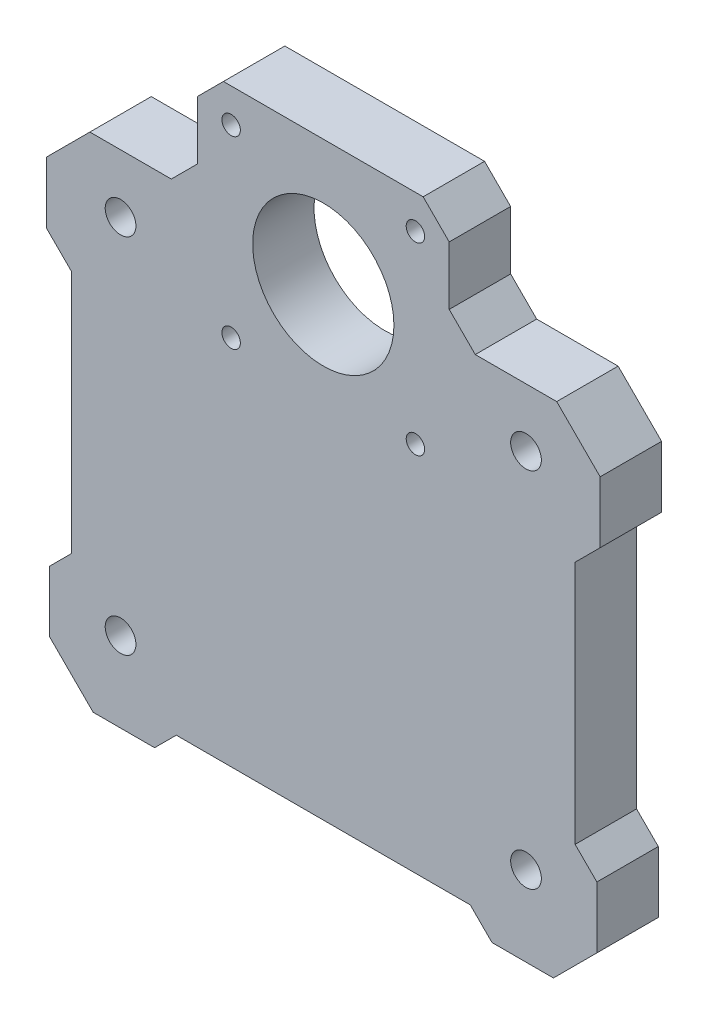
from build123d import *

# Parameters (mm, degrees)
SALIENTE_EXTRUIR5_DEPTH = 10
CROQUIS5_R              = 1.5
CORTAR_EXTRUIR1_DEPTH   = 71.922492906
SALIENTE_EXTRUIR7_DEPTH = 10
CORTAR_EXTRUIR2_DEPTH   = 74.351217807


with BuildPart() as part:
    # Croquis1 → Saliente-Extruir5 (new body)
    with BuildSketch(Plane.XY):
        with BuildLine():
            Line((-20.5, 29.5), (-30.5, 29.5))
            ThreePointArc((-30.5, 29.5), (-31.232233047, 27.732233047), (-33, 27))
            Line((-33, 27), (-33, -27))
            ThreePointArc((-33, -27), (-31.232233047, -27.732233047), (-30.5, -29.5))
            Line((-30.5, -29.5), (30.5, -29.5))
            ThreePointArc((30.5, -29.5), (31.232233047, -27.732233047), (33, -27))
            Line((33, -27), (33, 27))
            ThreePointArc((33, 27), (31.232233047, 27.732233047), (30.5, 29.5))
            Line((30.5, 29.5), (20.5, 29.5))
            Line((20.5, 29.5), (20.5, 16))
            Line((20.5, 16), (-20.5, 16))
            Line((-20.5, 16), (-20.5, 29.5))
        make_face()
        with BuildLine():
            Line((-9.124143795, 29.5), (-20.5, 29.5))
            Line((-20.5, 29.5), (-20.5, 16))
            Line((-20.5, 16), (20.5, 16))
            Line((20.5, 16), (20.5, 29.5))
            Line((20.5, 29.5), (9.124143795, 29.5))
            ThreePointArc((9.124143795, 29.5), (0, 25), (-9.124143795, 29.5))
        make_face()
        with BuildLine():
            ThreePointArc((-33, 27), (-34.767766953, 31.267766953), (-30.5, 29.5))
            Line((-30.5, 29.5), (-20.5, 29.5))
            Line((-20.5, 29.5), (-20.5, 39))
            Line((-20.5, 39), (-41, 39))
            Line((-41, 39), (-41, -39))
            Line((-41, -39), (41, -39))
            Line((41, -39), (41, 39))
            Line((41, 39), (20.5, 39))
            Line((20.5, 39), (20.5, 29.5))
            Line((20.5, 29.5), (30.5, 29.5))
            ThreePointArc((30.5, 29.5), (33, 32), (35.5, 29.5))
            ThreePointArc((35.5, 29.5), (34.767766953, 27.732233047), (33, 27))
            Line((33, 27), (33, -27))
            ThreePointArc((33, -27), (34.767766953, -27.732233047), (35.5, -29.5))
            ThreePointArc((35.5, -29.5), (33, -32), (30.5, -29.5))
            Line((30.5, -29.5), (-30.5, -29.5))
            ThreePointArc((-30.5, -29.5), (-34.767766953, -31.267766953), (-33, -27))
            Line((-33, -27), (-33, 27))
        make_face()
        with BuildLine():
            Line((-20.5, 57), (-20.5, 39))
            Line((-20.5, 39), (-11.22497216, 39))
            ThreePointArc((-11.22497216, 39), (0, 48), (11.22497216, 39))
            Line((11.22497216, 39), (20.5, 39))
            Line((20.5, 39), (20.5, 57))
            Line((20.5, 57), (-20.5, 57))
        make_face()
        with BuildLine():
            Line((-20.5, 39), (-20.5, 29.5))
            Line((-20.5, 29.5), (-9.124143795, 29.5))
            ThreePointArc((-9.124143795, 29.5), (-11.228718985, 34.016883016), (-11.22497216, 39))
            Line((-11.22497216, 39), (-20.5, 39))
        make_face()
        with BuildLine():
            ThreePointArc((11.5, 36.5), (10.889849715, 32.80389757), (9.124143795, 29.5))
            Line((9.124143795, 29.5), (20.5, 29.5))
            Line((20.5, 29.5), (20.5, 39))
            Line((20.5, 39), (11.22497216, 39))
            ThreePointArc((11.22497216, 39), (11.431036258, 37.757541283), (11.5, 36.5))
        make_face()
    extrude(amount=SALIENTE_EXTRUIR5_DEPTH)

    # Croquis5 → Cortar-Extruir1 (cut, through all)
    with BuildSketch(Plane.XY.offset(10)):
        with Locations((-15, 21.5)):
            Circle(CROQUIS5_R)
        with Locations((15, 21.5)):
            Circle(CROQUIS5_R)
        with Locations((15, 51.5)):
            Circle(CROQUIS5_R)
        with Locations((-15, 51.5)):
            Circle(CROQUIS5_R)
    extrude(amount=-CORTAR_EXTRUIR1_DEPTH, mode=Mode.SUBTRACT)

    # Croquis6 → Saliente-Extruir7 (add, through all)
    with BuildSketch(Plane.XY.offset(10)):
        Polygon((-41, 17.857864376), (-41, 36), (-45.071067812, 31.928932188), (-45.071067812, 21.928932188), align=None)
        Polygon((-20.5, 43.242640687), (-24.742640687, 39), (-20.5, 39), align=None)
        Polygon((20.5, 43.242640687), (20.5, 39), (24.742640687, 39), align=None)
        Polygon((45.071067812, 31.928932188), (41, 36), (41, 17.857864376), (45.071067812, 21.928932188), align=None)
        Polygon((41, -21.928932188), (41, -39), (44.535533906, -35.464466094), (44.535533906, -25.464466094), align=None)
        Polygon((41, -39), (23.928932188, -39), (27.464466094, -42.535533906), (37.464466094, -42.535533906), align=None)
        Polygon((-41, -39), (-41, -21.928932188), (-44.535533906, -25.464466094), (-44.535533906, -35.464466094), align=None)
        Polygon((-23.928932188, -39), (-41, -39), (-37.464466094, -42.535533906), (-27.464466094, -42.535533906), align=None)
    extrude(amount=-SALIENTE_EXTRUIR7_DEPTH)

    # Croquis7 → Cortar-Extruir2 (cut, through all)
    with BuildSketch(Plane.XY.offset(10)):
        Polygon((-20.5, 52.757359313), (-16.257359313, 57), (-20.5, 57), align=None)
        Polygon((20.5, 57), (16.257359313, 57), (20.5, 52.757359313), align=None)
        Polygon((-41, 39), (-41, 36), (-38, 39), align=None)
        Polygon((38, 39), (41, 36), (41, 39), align=None)
    extrude(amount=-CORTAR_EXTRUIR2_DEPTH, mode=Mode.SUBTRACT)


solid = part.part
